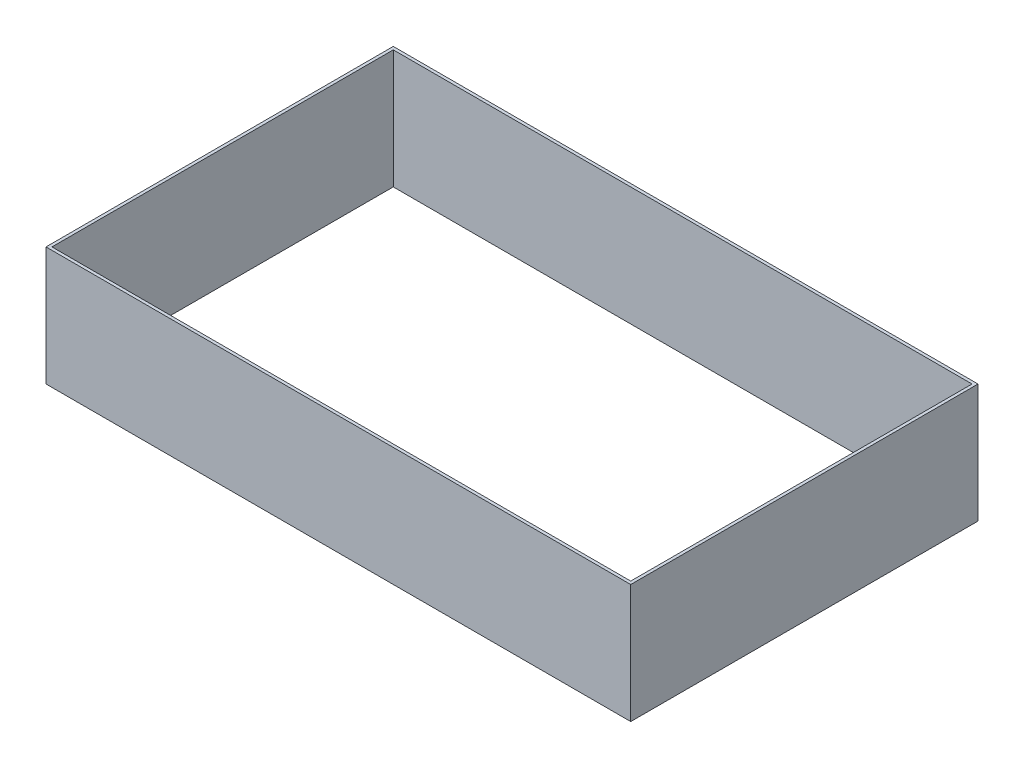
from build123d import *

# Parameters (mm, degrees)
SKETCH2_W           = 1970
SKETCH2_H           = 1170
SKETCH2_W_2         = 1950
SKETCH2_H_2         = 1150
EXTRUDE_THIN1_DEPTH = 400


with BuildPart() as part:
    # Sketch2 → Extrude-Thin1 (new body)
    with BuildSketch(Plane(origin=(0, 0, 0), x_dir=(1, 0, 0), z_dir=(0, 1, 0))):
        Rectangle(SKETCH2_W, SKETCH2_H)
        Rectangle(SKETCH2_W_2, SKETCH2_H_2, mode=Mode.SUBTRACT)
    extrude(amount=EXTRUDE_THIN1_DEPTH)


solid = part.part
